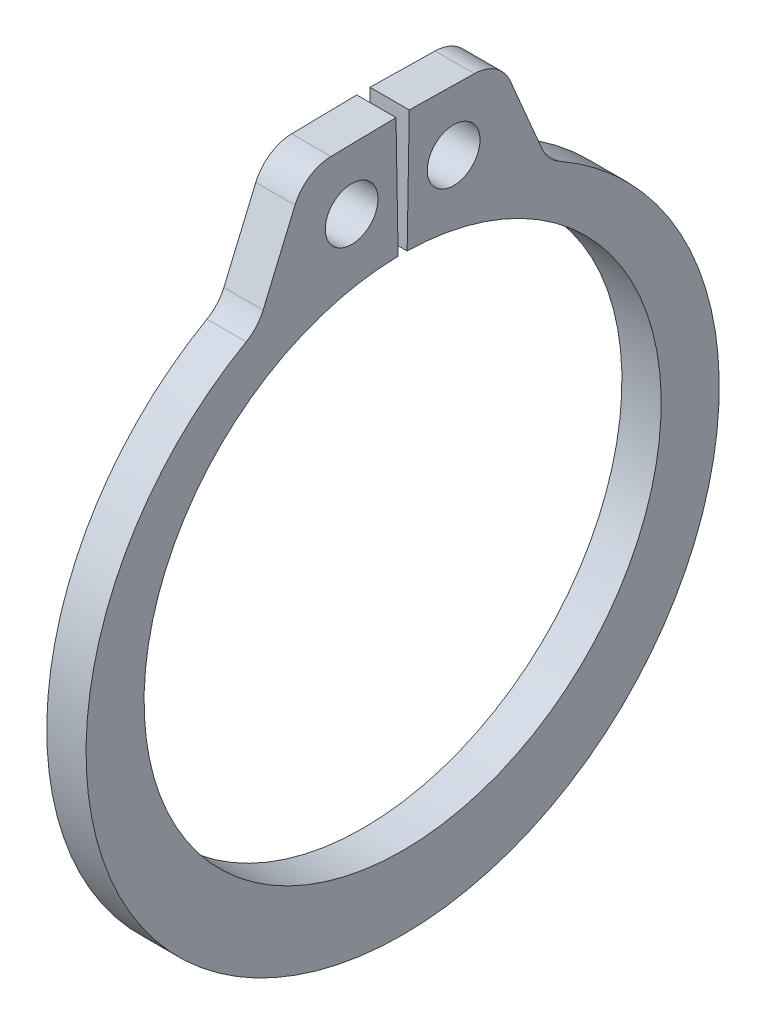
from build123d import *

# Parameters (mm, degrees)
SKETCH1_R      = 0.5969
EXTRUDE1_DEPTH = 0.4445
FILLET1_R      = 0.9017


with BuildPart() as part:
    # Sketch1 → Extrude1 (new, symmetric)
    with BuildSketch(Plane(origin=(0, 0, 0), x_dir=(0, 0, -1), z_dir=(1, 0, 0))):
        with BuildLine():
            Line((-0.102178604, 5.853808301), (-0.150054045, 8.596590498))
            Line((-0.150054045, 8.596590498), (-2.207140693, 8.560683917))
            Line((-2.207140693, 8.560683917), (-3.281285866, 6.036528932))
            ThreePointArc((-3.281285866, 6.036528932), (0, -7.5057), (3.281285866, 6.036528932))
            Line((3.281285866, 6.036528932), (2.207140693, 8.560683917))
            Line((2.207140693, 8.560683917), (0.150054045, 8.596590498))
            Line((0.150054045, 8.596590498), (0.102178604, 5.853808301))
            ThreePointArc((0.102178604, 5.853808301), (0, -5.8547), (-0.102178604, 5.853808301))
        make_face()
        with Locations((-1.154659649, 7.207246109)):
            Circle(SKETCH1_R, mode=Mode.SUBTRACT)
        with Locations((1.154659649, 7.207246109)):
            Circle(SKETCH1_R, mode=Mode.SUBTRACT)
    extrude(amount=EXTRUDE1_DEPTH, both=True)

    # Fillet1
    fillet1_edges = [part.edges().sort_by_distance(p)[0] for p in [
        (0, 8.560683917, -2.207140693),
        (0, 6.036528932, -3.281285866),
        (0, 6.036528932, 3.281285866),
        (0, 8.560683917, 2.207140693),
    ]]
    fillet(fillet1_edges, radius=FILLET1_R)


solid = part.part
